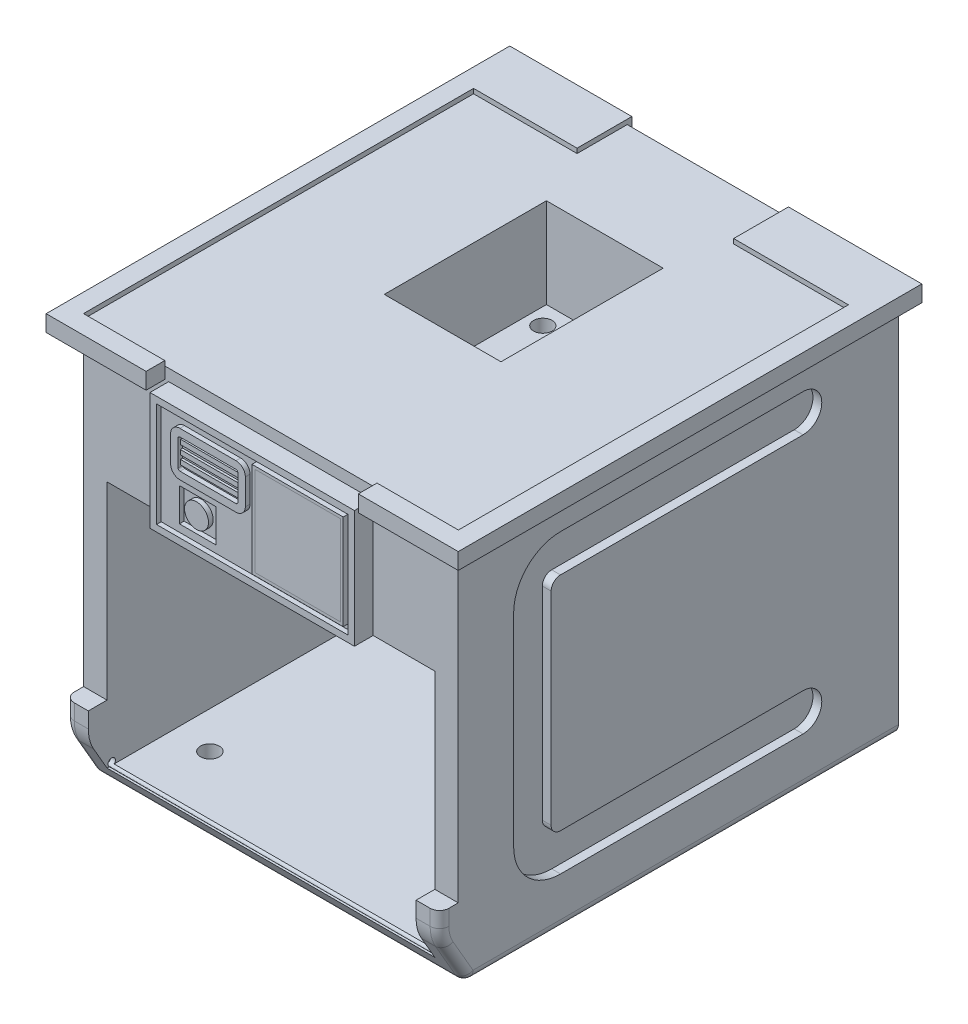
from build123d import *

# Parameters (mm, degrees)
SKETCH1_W             = 101.6
SKETCH1_H             = 124.46
EXTRUDE1_DEPTH        = 107.95
SKETCH2_W             = 101.6
SKETCH2_H             = 31.896869116
CUT_EXTRUDE1_DEPTH    = 5.08
CHAMFER1_SIZE         = 7.62
CHAMFER1_SIZE2        = 13.198227154
SKETCH3_W             = 57.552864312
SKETCH3_H             = 4.432668438
CUT_EXTRUDE2_DEPTH    = 5.08
SKETCH4_W             = 55.452041872
SKETCH4_H             = 31.896869116
EXTRUDE2_DEPTH        = 5.08
EXTRUDE3_DEPTH        = 5.08
SKETCH6_W             = 88.9
SKETCH6_H             = 67.221053395
EXTRUDE5_DEPTH        = 118.11
EXTRUDE6_DEPTH        = 2.387239506
SKETCH8_W             = 124.46
SKETCH8_H             = 4.432668438
EXTRUDE7_DEPTH        = 5.08
FILLET2_R             = 10.8966
FILLET1_R             = 2.54
SKETCH11_W            = 101.673610188
SKETCH11_H            = 105.789665407
EXTRUDE8_DEPTH        = 1.27
SKETCH12_W            = 33.121416728
SKETCH12_H            = 4.432668438
SKETCH12_W_2          = 36.17806772
EXTRUDE9_DEPTH        = 1.27
SKETCH13_W            = 42.460515552
SKETCH13_H            = 13.590334593
EXTRUDE10_DEPTH       = 1.27
SKETCH14_W            = 31.658728634
SKETCH14_H            = 43.98388253
EXTRUDE11_DEPTH       = 24.384
SKETCH18_W            = 51.896041872
SKETCH18_H            = 28.340869116
EXTRUDE12_DEPTH       = 1.27
SKETCH19_W            = 24.743015011
SKETCH19_H            = 25.768632214
EXTRUDE13_DEPTH       = 1.27
EXTRUDE_THIN1_DEPTH   = 1.27
SKETCH22_W            = 9.945877347
SKETCH22_H            = 8.987072842
EXTRUDE14_DEPTH       = 1.27
SKETCH23_R            = 3.249682988
EXTRUDE15_DEPTH       = 1.27
RIB7_REACH            = 176.426
SKETCH25_WALLS_W      = 365.194425131
SKETCH25_WALLS_H      = 1.27
CUT_EXTRUDE3_START    = -1.27
SKETCH26_R            = 1.003990475
CUT_EXTRUDE3_DEPTH    = 91.44
SKETCH27_R            = 2.220745834
EXTRUDE16_DEPTH       = 2.54
CROQUIS1_R            = 2.5146
CORTAR_EXTRUIR1_DEPTH = 7.62
CORTAR_EXTRUIR2_REACH = 139.142
CROQUIS2_R            = 2.54


with BuildPart() as part:
    # Sketch1 → Extrude1 (new body)
    with BuildSketch(Plane(origin=(0, 0, 0), x_dir=(1, 0, 0), z_dir=(0, 1, 0))):
        Rectangle(SKETCH1_W, SKETCH1_H)
    extrude(amount=EXTRUDE1_DEPTH)

    # Sketch2 → Cut-Extrude1 (cut)
    with BuildSketch(Plane.XY.offset(62.23)):
        with Locations((0, 87.568897004)):
            Rectangle(SKETCH2_W, SKETCH2_H)
    extrude(amount=-CUT_EXTRUDE1_DEPTH, mode=Mode.SUBTRACT)

    # Chamfer1
    chamfer1_edges = [part.edges().sort_by_distance(p)[0] for p in [
        (0, 0, 62.23),
    ]]
    chamfer1_side = [part.faces().sort_by_distance(p)[0] for p in [
        (0, 0, 0),
    ]]
    chamfer(chamfer1_edges, length=CHAMFER1_SIZE, length2=CHAMFER1_SIZE2, reference=chamfer1_side[0])

    # Sketch3 → Cut-Extrude2 (cut)
    with BuildSketch(Plane.XY.offset(62.23)):
        with Locations((0, 105.733665781)):
            Rectangle(SKETCH3_W, SKETCH3_H)
    extrude(amount=-CUT_EXTRUDE2_DEPTH, mode=Mode.SUBTRACT)

    # Sketch5 → Extrude3 (cut)
    with BuildSketch(Plane.XY.offset(62.23)):
        Polygon((-50.8, 71.620462446), (50.8, 71.620462446), (50.8, 20.362150317), (44.45, 20.362150317), (44.45, 0), (-44.45, 0), (-44.45, 20.362150317), (-50.8, 20.362150317), align=None)
    extrude(amount=-EXTRUDE3_DEPTH, mode=Mode.SUBTRACT)

    # Sketch6 → Extrude5 (cut)
    with BuildSketch(Plane.XY.offset(57.15)):
        with Locations((0, 38.009935749)):
            Rectangle(SKETCH6_W, SKETCH6_H)
    extrude(amount=-EXTRUDE5_DEPTH, mode=Mode.SUBTRACT)

    # Sketch7 → Extrude6 (cut)
    with BuildSketch(Plane(origin=(50.8, 0, 0), x_dir=(0, 0, -1), z_dir=(1, 0, 0))):
        with BuildLine():
            Line((-29.418039351, 23.444450079), (36.363567635, 23.444450079))
            ThreePointArc((36.363567635, 23.444450079), (41.443567635, 18.364450079), (36.363567635, 13.284450079))
            Line((36.363567635, 13.284450079), (-29.418039351, 13.284450079))
            ThreePointArc((-29.418039351, 13.284450079), (-38.398295472, 17.004193957), (-42.118039351, 25.984450079))
            Line((-42.118039351, 25.984450079), (-42.118039351, 80.989308106))
            ThreePointArc((-42.118039351, 80.989308106), (-38.398295472, 89.969564227), (-29.418039351, 93.689308106))
            Line((-29.418039351, 93.689308106), (36.363567635, 93.689308106))
            ThreePointArc((36.363567635, 93.689308106), (41.443567635, 88.609308106), (36.363567635, 83.529308106))
            Line((36.363567635, 83.529308106), (-29.418039351, 83.529308106))
            ThreePointArc((-29.418039351, 83.529308106), (-31.214090576, 82.78535933), (-31.958039351, 80.989308106))
            Line((-31.958039351, 80.989308106), (-31.958039351, 25.984450079))
            ThreePointArc((-31.958039351, 25.984450079), (-31.214090576, 24.188398854), (-29.418039351, 23.444450079))
        make_face()
    extrude6 = extrude(amount=-EXTRUDE6_DEPTH, mode=Mode.SUBTRACT)

    # Sketch8 → Extrude7 (add)
    with BuildSketch(Plane(origin=(50.8, 0, 0), x_dir=(0, 0, -1), z_dir=(1, 0, 0))):
        with Locations((0, 105.733665781)):
            Rectangle(SKETCH8_W, SKETCH8_H)
    extrude7 = extrude(amount=EXTRUDE7_DEPTH)

    # Mirror1: Extrude6, Extrude7 across plane
    add(extrude6.mirror(Plane(origin=(0, 0, 0), x_dir=(0, 0, 1), z_dir=(1, 0, 0))), mode=Mode.SUBTRACT)
    add(extrude7.mirror(Plane(origin=(0, 0, 0), x_dir=(0, 0, 1), z_dir=(1, 0, 0))))

    # Fillet2
    fillet2_edges = [part.edges().sort_by_distance(p)[0] for p in [
        (-47.625, 13.198227154, 62.23),
        (47.625, 13.198227154, 62.23),
    ]]
    fillet(fillet2_edges, radius=FILLET2_R)

    # Fillet1
    fillet1_edges = [part.edges().sort_by_distance(p)[0] for p in [
        (50.8, 5.334831162, 57.690066207),
        (-50.8, 13.297714717, 61.858707359),
        (50.8, 13.297714717, 61.858707359),
        (50.8, 0, -3.81),
        (0, 0, 54.61),
        (-50.8, 5.334831162, 57.690066207),
        (-50.8, 0, -3.81),
        (50.8, 18.240056321, 62.23),
        (-50.8, 18.240056321, 62.23),
    ]]
    fillet(fillet1_edges, radius=FILLET1_R)

    # Sketch11 → Extrude8 (cut)
    with BuildSketch(Plane(origin=(0, 107.95, 0), x_dir=(1, 0, 0), z_dir=(0, 1, 0))):
        with Locations((0, -4.255167297)):
            Rectangle(SKETCH11_W, SKETCH11_H)
    extrude(amount=-EXTRUDE8_DEPTH, mode=Mode.SUBTRACT)

    # Sketch12 → Extrude9 (add)
    with BuildSketch(Plane(origin=(0, 0, -62.23), x_dir=(-1, 0, 0), z_dir=(0, 0, -1))):
        with Locations((39.319291636, 105.733665781)):
            Rectangle(SKETCH12_W, SKETCH12_H)
        with Locations((-37.79096614, 105.733665781)):
            Rectangle(SKETCH12_W_2, SKETCH12_H)
    extrude(amount=EXTRUDE9_DEPTH)

    # Sketch13 → Extrude10 (cut)
    with BuildSketch(Plane(origin=(0, 107.95, 0), x_dir=(1, 0, 0), z_dir=(0, 1, 0))):
        with Locations((-1.528325496, 55.434832704)):
            Rectangle(SKETCH13_W, SKETCH13_H)
    extrude(amount=-EXTRUDE10_DEPTH, mode=Mode.SUBTRACT)

    # Sketch14 → Extrude11 (cut)
    with BuildSketch(Plane(origin=(0, 106.68, 0), x_dir=(1, 0, 0), z_dir=(0, 1, 0))):
        with Locations((0, 11.405438786)):
            Rectangle(SKETCH14_W, SKETCH14_H)
    extrude(amount=-EXTRUDE11_DEPTH, mode=Mode.SUBTRACT)



with BuildPart() as body_2:
    # Sketch4 → Extrude2 (new body)
    with BuildSketch(Plane.XY.offset(57.15)):
        with Locations((0, 87.568897004)):
            Rectangle(SKETCH4_W, SKETCH4_H)
    extrude(amount=EXTRUDE2_DEPTH)

    # Sketch18 → Extrude12 (cut)
    with BuildSketch(Plane.XY.offset(62.23)):
        with Locations((0, 87.568897004)):
            Rectangle(SKETCH18_W, SKETCH18_H)
    extrude(amount=-EXTRUDE12_DEPTH, mode=Mode.SUBTRACT)


with BuildPart() as part_1:
    add(part.part)

    add(body_2.part)  # Extrude13 merges body 2
    # Sketch19 → Extrude13 (add)
    with BuildSketch(Plane.XY.offset(60.96)):
        with Locations((12.306513431, 87.585015455)):
            Rectangle(SKETCH19_W, SKETCH19_H)
    extrude(amount=EXTRUDE13_DEPTH)

    # Sketch21 → Extrude-Thin1 (add)
    with BuildSketch(Plane.XY.offset(60.96)):
        with BuildLine():
            Line((-1.862156977, 96.614119657), (-1.862156977, 89.597442342))
            ThreePointArc((-1.862156977, 89.597442342), (-2.606105753, 87.801391117), (-4.402156977, 87.057442342))
            Line((-4.402156977, 87.057442342), (-19.599252013, 87.057442342))
            ThreePointArc((-19.599252013, 87.057442342), (-21.395303237, 87.801391117), (-22.139252013, 89.597442342))
            Line((-22.139252013, 89.597442342), (-22.139252013, 96.614119657))
            ThreePointArc((-22.139252013, 96.614119657), (-21.395303237, 98.410170882), (-19.599252013, 99.154119657))
            Line((-19.599252013, 99.154119657), (-4.402156977, 99.154119657))
            ThreePointArc((-4.402156977, 99.154119657), (-2.606105753, 98.410170882), (-1.862156977, 96.614119657))
        make_face()
        with BuildLine():
            Line((-3.894156977, 96.614119657), (-3.894156977, 89.597442342))
            ThreePointArc((-3.894156977, 89.597442342), (-4.042946732, 89.238232097), (-4.402156977, 89.089442342))
            Line((-4.402156977, 89.089442342), (-19.599252013, 89.089442342))
            ThreePointArc((-19.599252013, 89.089442342), (-19.958462257, 89.238232097), (-20.107252013, 89.597442342))
            Line((-20.107252013, 89.597442342), (-20.107252013, 96.614119657))
            ThreePointArc((-20.107252013, 96.614119657), (-19.958462257, 96.973329902), (-19.599252013, 97.122119657))
            Line((-19.599252013, 97.122119657), (-4.402156977, 97.122119657))
            ThreePointArc((-4.402156977, 97.122119657), (-4.042946732, 96.973329902), (-3.894156977, 96.614119657))
        make_face(mode=Mode.SUBTRACT)
    extrude(amount=EXTRUDE_THIN1_DEPTH)

    # Sketch22 → Extrude14 (cut)
    with BuildSketch(Plane.XY.offset(60.96)):
        with Locations((-16.035422345, 79.87877329)):
            Rectangle(SKETCH22_W, SKETCH22_H)
    extrude(amount=-EXTRUDE14_DEPTH, mode=Mode.SUBTRACT)

    # Sketch23 → Extrude15 (add)
    with BuildSketch(Plane.XY.offset(59.69)):
        with Locations((-16.371243285, 79.635756992)):
            Circle(SKETCH23_R)
    extrude(amount=EXTRUDE15_DEPTH)

    # Sketch25 walls → Rib7 (add, up to next)
    with BuildSketch(Plane.XY.offset(61.595), mode=Mode.PRIVATE) as rib7_sk1:
        with Locations((-12.627861278, 95.406703157)):
            Rectangle(SKETCH25_WALLS_W, SKETCH25_WALLS_H)
    rib7_tool1 = extrude(rib7_sk1.sketch, amount=-RIB7_REACH, mode=Mode.PRIVATE) - part_1.part
    # Sketch25 walls → Rib7 (add, up to next)
    with BuildSketch(Plane.XY.offset(61.595), mode=Mode.PRIVATE) as rib7_sk2:
        with Locations((-12.627861278, 92.98273445)):
            Rectangle(SKETCH25_WALLS_W, SKETCH25_WALLS_H)
    rib7_tool2 = extrude(rib7_sk2.sketch, amount=-RIB7_REACH, mode=Mode.PRIVATE) - part_1.part
    # Sketch25 walls → Rib7 (add, up to next)
    with BuildSketch(Plane.XY.offset(61.595), mode=Mode.PRIVATE) as rib7_sk3:
        with Locations((-12.627861278, 90.659764439)):
            Rectangle(SKETCH25_WALLS_W, SKETCH25_WALLS_H)
    rib7_tool3 = extrude(rib7_sk3.sketch, amount=-RIB7_REACH, mode=Mode.PRIVATE) - part_1.part
    add(rib7_tool1.solids().sort_by_distance((-12.627861278, 95.406703157, 61.595))[0])
    add(rib7_tool2.solids().sort_by_distance((-12.627861278, 92.98273445, 61.595))[0])
    add(rib7_tool3.solids().sort_by_distance((-12.627861278, 90.659764439, 61.595))[0])

    # Sketch26 → Cut-Extrude3 (cut)
    with BuildSketch(Plane(origin=(-44.45, 0, 0), x_dir=(0, 0, -1), z_dir=(1, 0, 0)).offset(CUT_EXTRUDE3_START)):
        with Locations((-55.88, 5.166171621)):
            Circle(SKETCH26_R)
    extrude(amount=CUT_EXTRUDE3_DEPTH, mode=Mode.SUBTRACT)

    # Sketch27 → Extrude16 (cut)
    with BuildSketch(Plane.ZY.offset(-15.829364317)):
        with Locations((-30.605485383, 94.372066286)):
            Circle(SKETCH27_R)
    extrude(amount=-EXTRUDE16_DEPTH, mode=Mode.SUBTRACT)

    # Croquis1 → Cortar-Extruir1 (cut)
    with BuildSketch(Plane(origin=(0, 82.296, 0), x_dir=(1, 0, 0), z_dir=(0, 1, 0))):
        with Locations(Location((-11.348635683, 27.936380051, 0), (0, 0, 270))):
            Circle(CROQUIS1_R)
        with Locations(Location((11.511364317, 27.936380051, 0), (0, 0, 270))):
            Circle(CROQUIS1_R)
        with Locations(Location((11.511364317, -5.083619949, 0), (0, 0, 270))):
            Circle(CROQUIS1_R)
        with Locations(Location((-11.348635683, -5.083619949, 0), (0, 0, 270))):
            Circle(CROQUIS1_R)
    extrude(amount=-CORTAR_EXTRUIR1_DEPTH, mode=Mode.SUBTRACT)

    # Croquis2 → Cortar-Extruir2 (cut, up to next)
    with BuildSketch(Plane.XZ, mode=Mode.PRIVATE) as cortar_extruir2_sk1:
        with Locations(Location((-34.4043, 39.302432116, 0), (0, 0, 270))):
            Circle(CROQUIS2_R)
    cortar_extruir2_tool1 = extrude(cortar_extruir2_sk1.sketch, amount=-CORTAR_EXTRUIR2_REACH, mode=Mode.PRIVATE) & part_1.part
    # Croquis2 → Cortar-Extruir2 (cut, up to next)
    with BuildSketch(Plane.XZ, mode=Mode.PRIVATE) as cortar_extruir2_sk2:
        with Locations(Location((34.4043, 39.302432116, 0), (0, 0, 270))):
            Circle(CROQUIS2_R)
    cortar_extruir2_tool2 = extrude(cortar_extruir2_sk2.sketch, amount=-CORTAR_EXTRUIR2_REACH, mode=Mode.PRIVATE) & part_1.part
    # Croquis2 → Cortar-Extruir2 (cut, up to next)
    with BuildSketch(Plane.XZ, mode=Mode.PRIVATE) as cortar_extruir2_sk3:
        with Locations(Location((34.4043, -48.387, 0), (0, 0, 270))):
            Circle(CROQUIS2_R)
    cortar_extruir2_tool3 = extrude(cortar_extruir2_sk3.sketch, amount=-CORTAR_EXTRUIR2_REACH, mode=Mode.PRIVATE) & part_1.part
    # Croquis2 → Cortar-Extruir2 (cut, up to next)
    with BuildSketch(Plane.XZ, mode=Mode.PRIVATE) as cortar_extruir2_sk4:
        with Locations(Location((-34.4043, -48.387, 0), (0, 0, 270))):
            Circle(CROQUIS2_R)
    cortar_extruir2_tool4 = extrude(cortar_extruir2_sk4.sketch, amount=-CORTAR_EXTRUIR2_REACH, mode=Mode.PRIVATE) & part_1.part
    add(cortar_extruir2_tool1.solids().sort_by_distance((-34.4043, 0, 39.302432))[0], mode=Mode.SUBTRACT)
    add(cortar_extruir2_tool2.solids().sort_by_distance((34.4043, 0, 39.302432))[0], mode=Mode.SUBTRACT)
    add(cortar_extruir2_tool3.solids().sort_by_distance((34.4043, 0, -48.387))[0], mode=Mode.SUBTRACT)
    add(cortar_extruir2_tool4.solids().sort_by_distance((-34.4043, 0, -48.387))[0], mode=Mode.SUBTRACT)


solid = part_1.part
